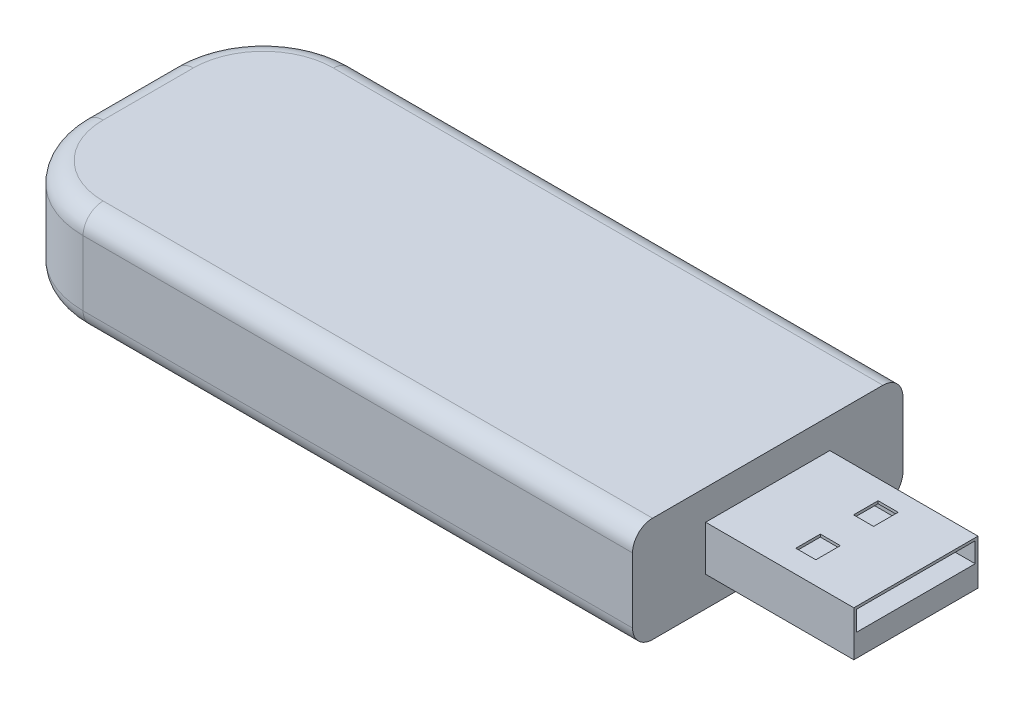
from build123d import *

# Parameters (mm, degrees)
BOSS_EXTRUDE1_DEPTH = 10.5
FILLET3_R           = 2
SKETCH3_W           = 12.4
SKETCH3_H           = 4.5
SKETCH3_W_2         = 11.854567875
SKETCH3_H_2         = 1.988610451
BOSS_EXTRUDE2_DEPTH = 14.8
SKETCH4_W           = 2
SKETCH4_H           = 2.45
CUT_EXTRUDE1_DEPTH  = 1


with BuildPart() as part:
    # Sketch1 → Boss-Extrude1 (new body)
    with BuildSketch(Plane(origin=(0, 0, 0), x_dir=(1, 0, 0), z_dir=(0, 1, 0))):
        with BuildLine():
            ThreePointArc((-77.532758891, -19.20955436), (-83.896719922, -16.57351539), (-86.532758891, -10.20955436))
            Line((-86.532758891, -10.20955436), (-86.532758891, -1.20955436))
            ThreePointArc((-86.532758891, -1.20955436), (-83.896719922, 5.154406671), (-77.532758891, 7.79044564))
            Line((-77.532758891, 7.79044564), (-22.663339977, 7.79044564))
            Line((-22.663339977, 7.79044564), (-22.663339977, -19.20955436))
            Line((-22.663339977, -19.20955436), (-77.532758891, -19.20955436))
        make_face()
    extrude(amount=BOSS_EXTRUDE1_DEPTH)

    # Fillet3
    fillet3_edges = [part.edges().sort_by_distance(p)[0] for p in [
        (-50.098049434, 10.5, -7.79044564),
        (-83.896719922, 10.5, -5.154406671),
        (-86.532758891, 10.5, 5.70955436),
        (-83.896719922, 10.5, 16.57351539),
        (-86.532758891, 0, 5.70955436),
        (-83.896719922, 0, -5.154406671),
        (-50.098049434, 0, -7.79044564),
        (-50.098049434, 10.5, 19.20955436),
        (-50.098049434, 0, 19.20955436),
        (-83.896719922, 0, 16.57351539),
    ]]
    fillet(fillet3_edges, radius=FILLET3_R)

    # Sketch3 → Boss-Extrude2 (add)
    with BuildSketch(Plane(origin=(-22.663339977, 0, 0), x_dir=(0, 0, -1), z_dir=(1, 0, 0))):
        with Locations((-5.70955436, 5.25)):
            Rectangle(SKETCH3_W, SKETCH3_H)
        with Locations((-5.717006669, 6.244305225)):
            Rectangle(SKETCH3_W_2, SKETCH3_H_2, mode=Mode.SUBTRACT)
    extrude(amount=BOSS_EXTRUDE2_DEPTH)

    # Sketch4 → Cut-Extrude1 (cut)
    with BuildSketch(Plane(origin=(0, 7.5, 0), x_dir=(1, 0, 0), z_dir=(0, 1, 0))):
        with Locations((-14.913433207, -2.660071761)):
            Rectangle(SKETCH4_W, SKETCH4_H)
        with Locations((-14.913433207, -8.429959353)):
            Rectangle(SKETCH4_W, SKETCH4_H)
    extrude(amount=-CUT_EXTRUDE1_DEPTH, mode=Mode.SUBTRACT)


solid = part.part
